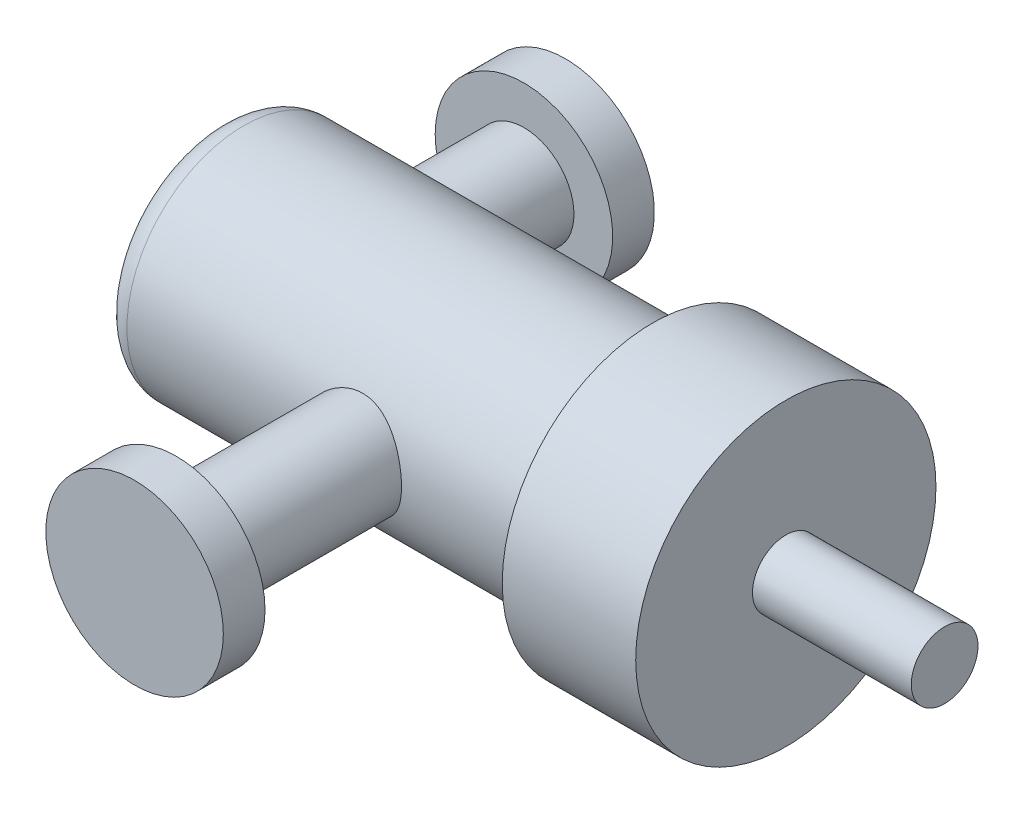
from build123d import *

# Parameters (mm, degrees)
SKETCH1_R      = 22.225
EXTRUDE1_DEPTH = 82.55
SKETCH2_R      = 9.525
EXTRUDE2_DEPTH = 63.5
SKETCH3_R      = 9.525
EXTRUDE3_DEPTH = 46.99
SKETCH4_R      = 16.891
EXTRUDE4_DEPTH = 7.9375
SKETCH5_R      = 16.891
EXTRUDE5_DEPTH = 7.9375
SKETCH6_R      = 28.575
EXTRUDE6_DEPTH = 25.4
SKETCH7_R      = 6.35
EXTRUDE7_DEPTH = 30.226
FILLET1_R      = 4.7625


with BuildPart() as part:
    # Sketch1 → Extrude1 (new body)
    with BuildSketch(Plane(origin=(0, 0, 0), x_dir=(0, 0, -1), z_dir=(1, 0, 0))):
        Circle(SKETCH1_R)
    extrude(amount=EXTRUDE1_DEPTH)

    # Sketch2 → Extrude2 (add)
    with BuildSketch(Plane.XY):
        with Locations((47.498, 0)):
            Circle(SKETCH2_R)
    extrude(amount=EXTRUDE2_DEPTH)

    # Sketch3 → Extrude3 (add)
    with BuildSketch(Plane.XY):
        with Locations((19.05, 0)):
            Circle(SKETCH3_R)
    extrude(amount=-EXTRUDE3_DEPTH)

    # Sketch4 → Extrude4 (add)
    with BuildSketch(Plane(origin=(0, 0, -46.99), x_dir=(-1, 0, 0), z_dir=(0, 0, -1))):
        with Locations((-19.05, 0)):
            Circle(SKETCH4_R)
    extrude(amount=-EXTRUDE4_DEPTH)

    # Sketch5 → Extrude5 (add)
    with BuildSketch(Plane.XY.offset(63.5)):
        with Locations((47.498, 0)):
            Circle(SKETCH5_R)
    extrude(amount=-EXTRUDE5_DEPTH)

    # Sketch6 → Extrude6 (add)
    with BuildSketch(Plane(origin=(82.55, 0, 0), x_dir=(0, 0, -1), z_dir=(1, 0, 0))):
        Circle(SKETCH6_R)
    extrude(amount=EXTRUDE6_DEPTH)

    # Sketch7 → Extrude7 (add)
    with BuildSketch(Plane(origin=(107.95, 0, 0), x_dir=(0, 0, -1), z_dir=(1, 0, 0))):
        Circle(SKETCH7_R)
    extrude(amount=EXTRUDE7_DEPTH)

    # Fillet1
    fillet1_edges = [part.edges().sort_by_distance(p)[0] for p in [
        (0, 0, 22.225),
    ]]
    fillet(fillet1_edges, radius=FILLET1_R)


solid = part.part
